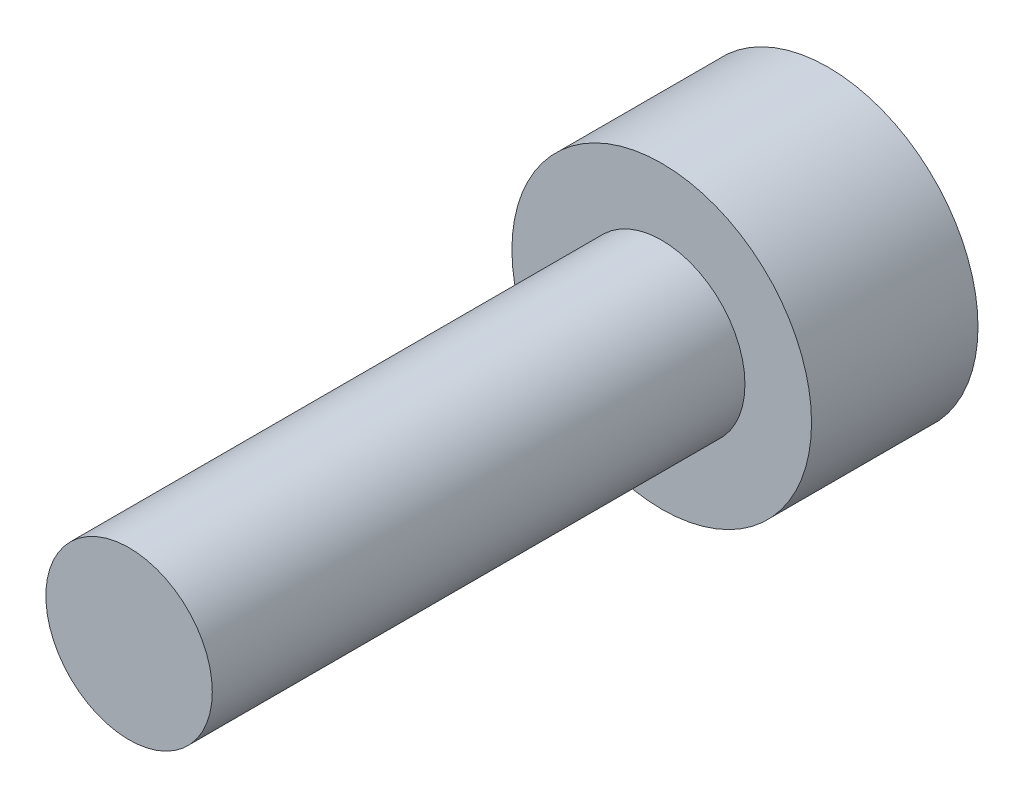
from build123d import *

# Parameters (mm, degrees)
CABEZA_START            = -2.5
CROQUIS1_R              = 2.25
CABEZA_DEPTH            = 2.5
CROQUIS2_R              = 1.25
CUERPO_DEPTH            = 8
HEXAGONO_INTERIOR_START = -2.5
HEXAGONO_INTERIOR_DEPTH = 1.1


with BuildPart() as part:
    # Croquis1 → Cabeza (new body)
    with BuildSketch(Plane.XY.offset(CABEZA_START)):
        Circle(CROQUIS1_R)
    extrude(amount=CABEZA_DEPTH)

    # Croquis2 → Cuerpo (add)
    with BuildSketch(Plane.XY):
        Circle(CROQUIS2_R)
    extrude(amount=CUERPO_DEPTH)

    # Croquis3 → Hexagono_interior (cut)
    with BuildSketch(Plane.XY.offset(HEXAGONO_INTERIOR_START)):
        Polygon((1.154700538, 0), (0.577350269, 1), (-0.577350269, 1), (-1.154700538, 0), (-0.577350269, -1), (0.577350269, -1), align=None)
    extrude(amount=HEXAGONO_INTERIOR_DEPTH, mode=Mode.SUBTRACT)


solid = part.part
